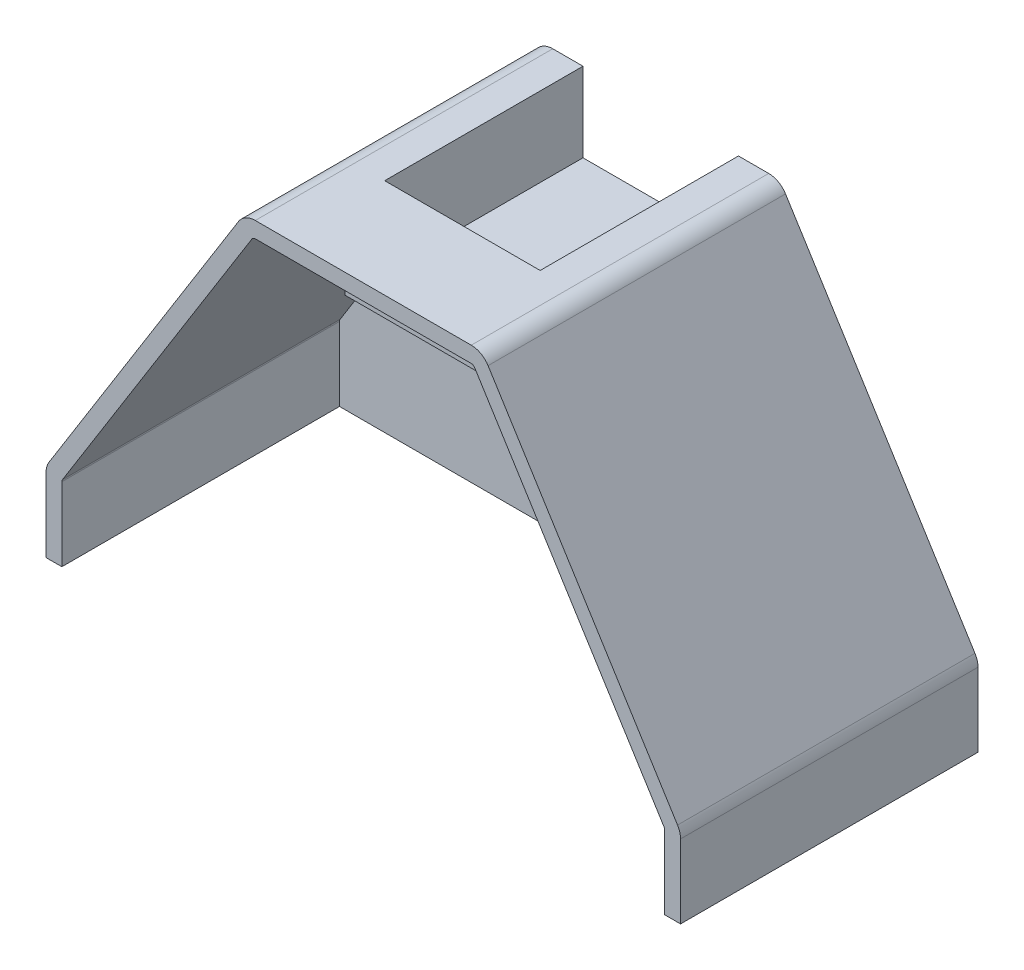
from build123d import *

# Parameters (mm, degrees)
BOSS_EXTRUDE1_DEPTH = 5
FILLET1_R           = 5
FILLET2_R           = 5
FILLET3_R           = 5
FILLET4_R           = 5
BOSS_EXTRUDE2_START = 70
BOSS_EXTRUDE2_DEPTH = 70
SKETCH3_W           = 49.2
SKETCH3_H           = 25
BOSS_EXTRUDE3_DEPTH = 55
SKETCH4_W           = 39.2
SKETCH4_H           = 50
CUT_EXTRUDE1_DEPTH  = 20


with BuildPart() as part:
    # Sketch1 → Boss-Extrude1 (new body)
    with BuildSketch(Plane.XY):
        Polygon((-30, 0), (30, 0), (80, -80), (80, -100), (-80, -100), (-80, -80), align=None)
    extrude(amount=BOSS_EXTRUDE1_DEPTH)

    # Fillet1
    fillet1_edges = [part.edges().sort_by_distance(p)[0] for p in [
        (-30, 0, 2.5),
    ]]
    fillet(fillet1_edges, radius=FILLET1_R)

    # Fillet2
    fillet2_edges = [part.edges().sort_by_distance(p)[0] for p in [
        (30, 0, 2.5),
    ]]
    fillet(fillet2_edges, radius=FILLET2_R)

    # Fillet3
    fillet3_edges = [part.edges().sort_by_distance(p)[0] for p in [
        (80, -80, 2.5),
    ]]
    fillet(fillet3_edges, radius=FILLET3_R)

    # Fillet4
    fillet4_edges = [part.edges().sort_by_distance(p)[0] for p in [
        (-80, -80, 2.5),
    ]]
    fillet(fillet4_edges, radius=FILLET4_R)

    # Sketch2 → Boss-Extrude2 (add)
    with BuildSketch(Plane.XY.offset(5).offset(BOSS_EXTRUDE2_START)):
        with BuildLine():
            Line((76, -100), (76, -81.433981132))
            ThreePointArc((76, -81.433981132), (75.961248746, -81.158298619), (75.847998304, -80.903982192))
            Line((75.847998304, -80.903982192), (28.076760096, -4.47000106))
            ThreePointArc((28.076760096, -4.47000106), (27.713530325, -4.125357519), (27.228761792, -4))
            Line((27.228761792, -4), (-27.228761792, -4))
            ThreePointArc((-27.228761792, -4), (-27.713530325, -4.125357519), (-28.076760096, -4.47000106))
            Line((-28.076760096, -4.47000106), (-75.847998304, -80.903982192))
            ThreePointArc((-75.847998304, -80.903982192), (-75.961248746, -81.158298619), (-76, -81.433981132))
            Line((-76, -81.433981132), (-76, -100))
            Line((-76, -100), (-80, -100))
            Line((-80, -100), (-80, -81.433981132))
            ThreePointArc((-80, -81.433981132), (-79.806243731, -80.055568567), (-79.23999152, -78.783986432))
            Line((-79.23999152, -78.783986432), (-31.468753312, -2.3500053))
            ThreePointArc((-31.468753312, -2.3500053), (-29.652604454, -0.626787594), (-27.228761792, 0))
            Line((-27.228761792, 0), (27.228761792, 0))
            ThreePointArc((27.228761792, 0), (29.652604454, -0.626787594), (31.468753312, -2.3500053))
            Line((31.468753312, -2.3500053), (79.23999152, -78.783986432))
            ThreePointArc((79.23999152, -78.783986432), (79.806243731, -80.055568567), (80, -81.433981132))
            Line((80, -81.433981132), (80, -100))
            Line((80, -100), (76, -100))
        make_face()
    extrude(amount=-BOSS_EXTRUDE2_DEPTH)

    # Sketch3 → Boss-Extrude3 (add)
    with BuildSketch(Plane(origin=(0, 0, 0), x_dir=(-1, 0, 0), z_dir=(0, 0, -1))):
        with Locations((0, -12.5)):
            Rectangle(SKETCH3_W, SKETCH3_H)
    extrude(amount=-BOSS_EXTRUDE3_DEPTH)

    # Sketch4 → Cut-Extrude1 (cut)
    with BuildSketch(Plane(origin=(0, 0, 0), x_dir=(1, 0, 0), z_dir=(0, 1, 0))):
        with Locations((0, -25)):
            Rectangle(SKETCH4_W, SKETCH4_H)
    extrude(amount=-CUT_EXTRUDE1_DEPTH, mode=Mode.SUBTRACT)


solid = part.part
